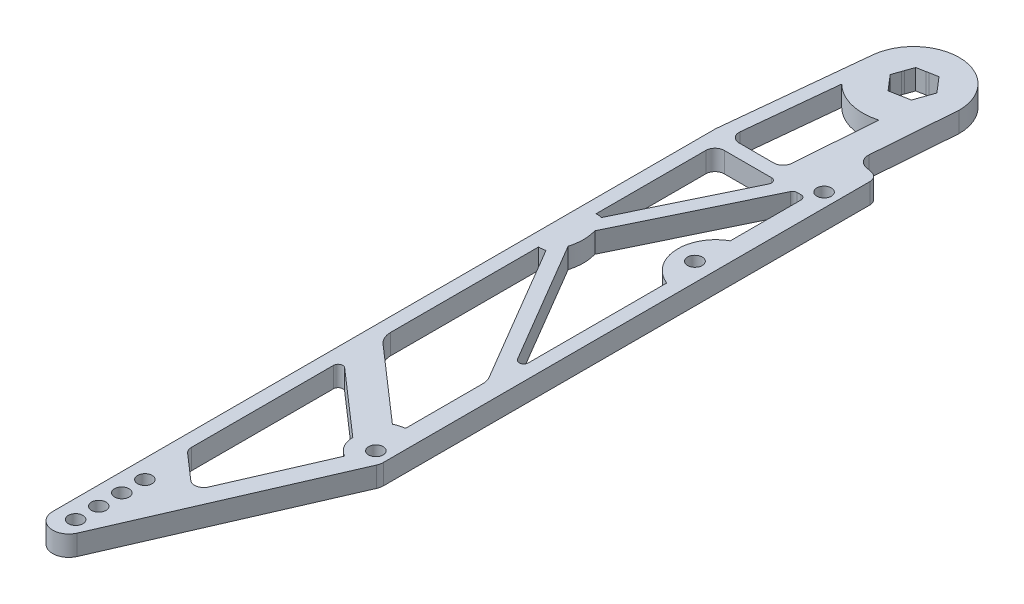
from build123d import *

# Parameters (mm, degrees)
SKETCH2_R           = 2
SKETCH2_R_2         = 1.999999991
BOSS_EXTRUDE1_DEPTH = 5.588
SKETCH7_R           = 2.032
CUT_EXTRUDE1_DEPTH  = 5.588
CUT_EXTRUDE2_DEPTH  = 226.492641696


with BuildPart() as part:
    # Sketch2 → Boss-Extrude1 (new body)
    with BuildSketch(Plane(origin=(0, 0, 0), x_dir=(1, 0, 0), z_dir=(0, 1, 0))):
        with BuildLine():
            ThreePointArc((17.295902343, -29.323452593), (16.73639375, -27.733089808), (15.304363929, -26.843373987))
            Line((15.304363929, -26.843373987), (13.284423018, -26.396670406))
            ThreePointArc((13.284423018, -26.396670406), (11.420627025, -25.189010374), (10.804170553, -23.055431298))
            Line((10.804170553, -23.055431298), (12.5603, 0))
            ThreePointArc((12.5603, 0), (0.640974044, 12.543934326), (-12.49487995, 1.28027775))
            Line((-12.49487995, 1.28027775), (-16.496770465, -37.776201638))
            ThreePointArc((-16.496770465, -37.776201638), (-16.50669046, -37.90548449), (-16.51, -38.035105126))
            Line((-16.51, -38.035105126), (-16.51, -220.313887427))
            ThreePointArc((-16.51, -220.313887427), (-12.970187584, -224.665744552), (-7.988667969, -222.086327038))
            Line((-7.988667969, -222.086327038), (16.979901226, -164.662549258))
            ThreePointArc((16.979901226, -164.662549258), (17.216065593, -163.919190378), (17.295902343, -163.143315306))
            Line((17.295902343, -163.143315306), (17.295902343, -29.323452593))
        make_face()
        with Locations(Location((-11.43, -219.075, 0), (0, 0, 270))):
            Circle(SKETCH2_R, mode=Mode.SUBTRACT)
        with Locations(Location((-11.43, -212.725, 0), (0, 0, 270))):
            Circle(SKETCH2_R, mode=Mode.SUBTRACT)
        with Locations(Location((-11.43, -206.375, 0), (0, 0, 270))):
            Circle(SKETCH2_R, mode=Mode.SUBTRACT)
        with Locations(Location((-11.43, -200.025, 0), (0, 0, 270))):
            Circle(SKETCH2_R, mode=Mode.SUBTRACT)
        with BuildLine():
            ThreePointArc((7.135902343, -161.395796446), (8.023611961, -164.633987883), (10.438542905, -166.966801782))
            Line((10.438542905, -166.966801782), (-0.894016375, -193.029903785))
            ThreePointArc((-0.894016375, -193.029903785), (-2.665854515, -194.495144898), (-4.89449504, -193.929898651))
            Line((-4.89449504, -193.929898651), (-11.831146076, -187.869646091))
            ThreePointArc((-11.831146076, -187.869646091), (-12.472607947, -187.007278248), (-12.7, -185.95682859))
            Line((-12.7, -185.95682859), (-12.7, -146.861981888))
            ThreePointArc((-12.7, -146.861981888), (-11.955224829, -145.705677915), (-10.594426962, -145.905573138))
            Line((-10.594426962, -145.905573138), (7.135902343, -161.395796446))
        make_face(mode=Mode.SUBTRACT)
        with BuildLine():
            ThreePointArc((12.215902343, -151.955842791), (10.785297541, -152.261664921), (9.418398214, -152.782955151))
            Line((9.418398214, -152.782955151), (-10.962292152, -134.977225798))
            ThreePointArc((-10.962292152, -134.977225798), (-12.245215894, -133.252490112), (-12.7, -131.151590796))
            Line((-12.7, -131.151590796), (-12.7, -90.4875))
            ThreePointArc((-12.7, -90.4875), (-11.765673597, -90.432318214), (-10.844338135, -90.267540106))
            Line((-10.844338135, -90.267540106), (11.513275375, -128.23323342))
            ThreePointArc((11.513275375, -128.23323342), (12.037098881, -129.475107855), (12.215902343, -130.811024207))
            Line((12.215902343, -130.811024207), (12.215902343, -151.955842791))
        make_face(mode=Mode.SUBTRACT)
        with Locations(Location((13.485902343, -161.395796446, 0), (0, 0, 270))):
            Circle(SKETCH2_R, mode=Mode.SUBTRACT)
        with BuildLine():
            Line((-10.16, -41.91), (2.838491406, -41.91))
            ThreePointArc((2.838491406, -41.91), (3.914572403, -42.505500417), (3.981509018, -43.733543799))
            Line((3.981509018, -43.733543799), (-11.055993219, -74.784618621))
            ThreePointArc((-11.055993219, -74.784618621), (-11.873503915, -74.655646925), (-12.7, -74.6125))
            Line((-12.7, -74.6125), (-12.7, -44.45))
            ThreePointArc((-12.7, -44.45), (-11.956051224, -42.653948776), (-10.16, -41.91))
        make_face(mode=Mode.SUBTRACT)
        with BuildLine():
            ThreePointArc((-9.886442157, -38.1), (-11.771808813, -37.262055396), (-12.413212622, -35.301096512))
            Line((-12.413212622, -35.301096512), (-9.81475239, -9.941405108))
            ThreePointArc((-9.81475239, -9.941405108), (-3.431386466, -13.542026692), (3.896359547, -13.415635739))
            Line((3.896359547, -13.415635739), (2.194931831, -35.752912681))
            ThreePointArc((2.194931831, -35.752912681), (1.388767881, -37.42300808), (-0.337731726, -38.1))
            Line((-0.337731726, -38.1), (-9.886442157, -38.1))
        make_face(mode=Mode.SUBTRACT)
        with BuildLine():
            ThreePointArc((3.111707299, -3.622128204), (-4.505881672, 1.581001391), (4.69270869, 0.883753468))
            Line((4.69270869, 0.883753468), (3.111707299, -3.622128204))
        make_face(mode=Mode.SUBTRACT)
        with BuildLine():
            ThreePointArc((-8.804706991, -86.222769023), (-8.262040897, -82.55), (-8.804706991, -78.877230977))
            Line((-8.804706991, -78.877230977), (8.75092063, -42.626456201))
            ThreePointArc((8.75092063, -42.626456201), (9.219438659, -42.103919003), (9.893938242, -41.91))
            Line((9.893938242, -41.91), (10.945902343, -41.91))
            ThreePointArc((10.945902343, -41.91), (11.843927955, -42.281974388), (12.215902343, -43.18))
            Line((12.215902343, -43.18), (12.215902343, -62.618124667))
            ThreePointArc((12.215902343, -62.618124667), (6.906756389, -72.428110561), (13.516748759, -81.413145613))
            Line((13.516748759, -81.413145613), (13.516748759, -119.431411199))
            ThreePointArc((13.516748759, -119.431411199), (12.599191369, -120.688899116), (11.152950849, -120.113072943))
            Line((11.152950849, -120.113072943), (-8.804706991, -86.222769023))
        make_face(mode=Mode.SUBTRACT)
        with Locations(Location((13.485902343, -38.1, 0), (0, 0, 270))):
            Circle(SKETCH2_R_2, mode=Mode.SUBTRACT)
    extrude(amount=BOSS_EXTRUDE1_DEPTH)

    # Sketch7 → Cut-Extrude1 (cut)
    with BuildSketch(Plane(origin=(0, 5.588, 0), x_dir=(1, 0, 0), z_dir=(0, 1, 0))):
        with Locations(Location((12.215902343, -72.362149281, 0), (0, 0, 270))):
            Circle(SKETCH7_R)
    extrude(amount=-CUT_EXTRUDE1_DEPTH, mode=Mode.SUBTRACT)

    # Sketch8 → Cut-Extrude2 (cut, through all)
    with BuildSketch(Plane(origin=(0, 5.588, 0), x_dir=(1, 0, 0), z_dir=(0, 1, 0))):
        Polygon((1.820727883, 5.189106375), (-3.583534002, 4.171349788), (-5.404261886, -1.017756587), (-1.820727883, -5.189106375), (3.583534002, -4.171349788), (5.404261886, 1.017756587), align=None)
    extrude(amount=-CUT_EXTRUDE2_DEPTH, mode=Mode.SUBTRACT)


solid = part.part
